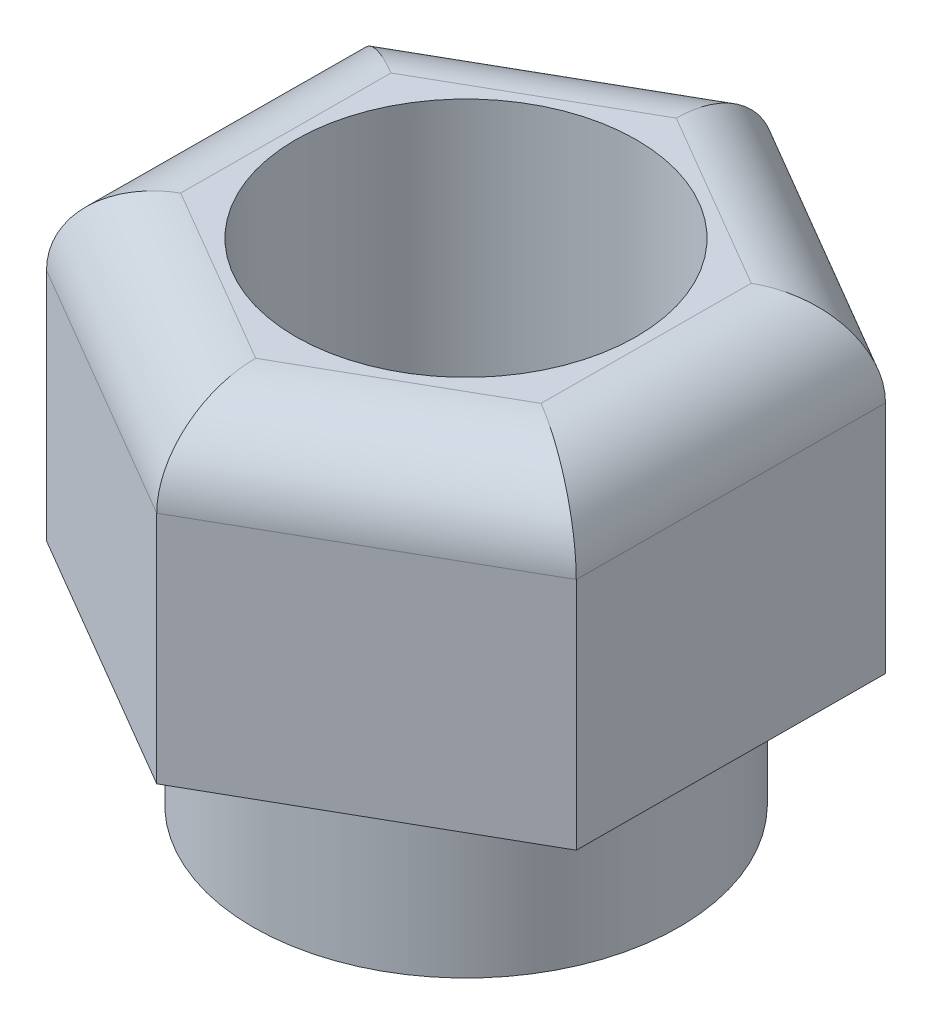
from build123d import *

# Parameters (mm, degrees)
SKETCH1_R           = 10
BOSS_EXTRUDE1_DEPTH = 8
BOSS_EXTRUDE2_DEPTH = 15
CUT_EXTRUDE1_REACH  = 31.909
SKETCH3_R           = 8
FILLET1_R           = 4


with BuildPart() as part:
    # Sketch1 → Boss-Extrude1 (new body)
    with BuildSketch(Plane(origin=(0, 0, 0), x_dir=(1, 0, 0), z_dir=(0, 1, 0))):
        with Locations(Location((0, 0, 0), (0, 0, 270))):
            Circle(SKETCH1_R)
    extrude(amount=BOSS_EXTRUDE1_DEPTH)

    # Sketch2 → Boss-Extrude2 (add)
    with BuildSketch(Plane(origin=(0, 8, 0), x_dir=(1, 0, 0), z_dir=(0, 1, 0))):
        Polygon((12.460098185, -7.285553277), (12.539523311, 7.147984923), (0.079425127, 14.4335382), (-12.460098185, 7.285553277), (-12.539523311, -7.147984923), (-0.079425127, -14.4335382), align=None)
    extrude(amount=BOSS_EXTRUDE2_DEPTH)

    # Sketch3 → Cut-Extrude1 (cut, up to next)
    with BuildSketch(Plane.XZ, mode=Mode.PRIVATE) as cut_extrude1_sk1:
        with Locations(Location((0, 0, 0), (0, 0, 270))):
            Circle(SKETCH3_R)
    cut_extrude1_tool1 = extrude(cut_extrude1_sk1.sketch, amount=-CUT_EXTRUDE1_REACH, mode=Mode.PRIVATE) & part.part
    add(cut_extrude1_tool1.solids().sort_by_distance((0, 0, 0))[0], mode=Mode.SUBTRACT)

    # Fillet1
    fillet1_edges = [part.edges().sort_by_distance(p)[0] for p in [
        (6.190336529, 23, 10.859545739),
        (12.499810748, 23, 0.068784177),
        (6.309474219, 23, -10.790761562),
        (-6.190336529, 23, -10.859545739),
        (-12.499810748, 23, -0.068784177),
        (-6.309474219, 23, 10.790761562),
    ]]
    fillet(fillet1_edges, radius=FILLET1_R)


solid = part.part
